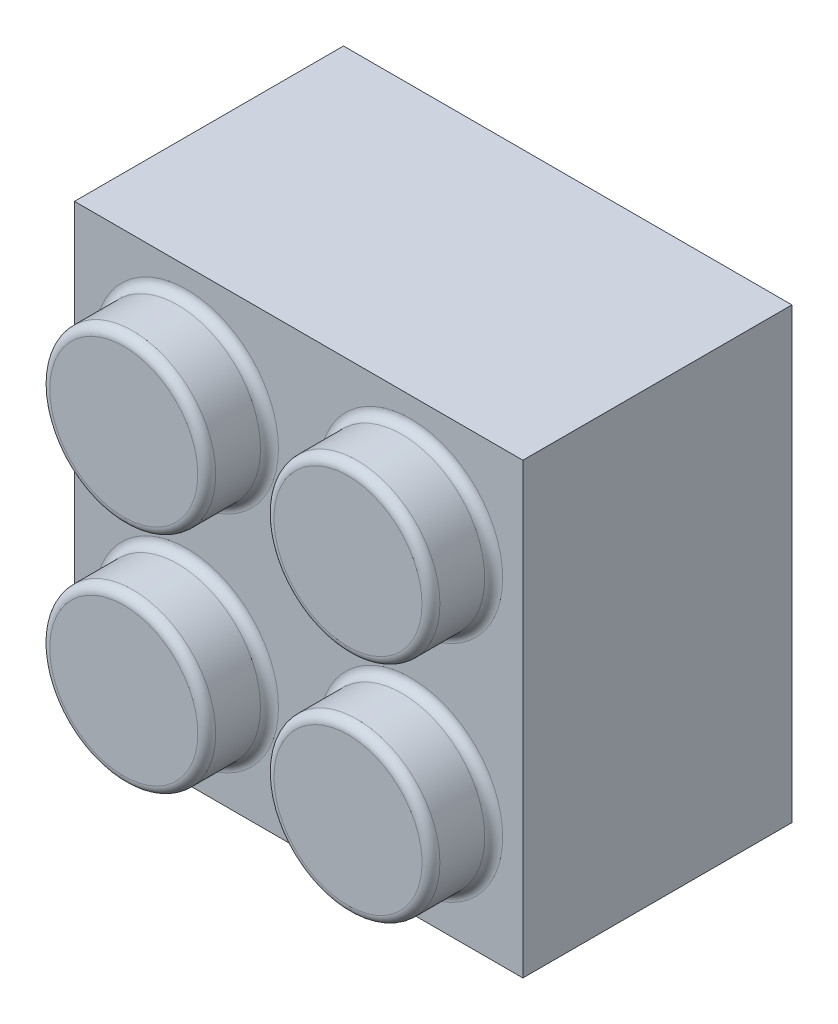
from build123d import *

# Parameters (mm, degrees)
ESQUISSE2_W             = 100
ESQUISSE2_H             = 100
BOSS_EXTRU_1_DEPTH      = 60
ESQUISSE3_R             = 18.5
BOSS_EXTRU_2_DEPTH      = 14
ESQUISSE4_W             = 84
ESQUISSE4_H             = 84
ESQUISSE4_R             = 18.5
ESQUISSE4_R_2           = 12
ENL_V_MAT_EXTRU_4_DEPTH = 50
CONG_1_R                = 2


with BuildPart() as part:
    # Esquisse2 → Boss.-Extru.1 (new body)
    with BuildSketch(Plane.XY):
        Rectangle(ESQUISSE2_W, ESQUISSE2_H)
    extrude(amount=BOSS_EXTRU_1_DEPTH)

    # Esquisse3 → Boss.-Extru.2 (add)
    with BuildSketch(Plane.XY.offset(60)):
        with Locations((25, 25)):
            Circle(ESQUISSE3_R)
        with Locations(Location((25, -25, 0), (0, 0, 180))):
            Circle(ESQUISSE3_R)
        with Locations(Location((-25, 25, 0), (0, 0, 180))):
            Circle(ESQUISSE3_R)
        with Locations((-25, -25)):
            Circle(ESQUISSE3_R)
    extrude(amount=BOSS_EXTRU_2_DEPTH)

    # Esquisse4 → Enlèv. mat.-Extru.4 (cut)
    # profile 1 of 2: a face of its own
    with BuildSketch(Plane(origin=(0, 0, 0), x_dir=(-1, 0, 0), z_dir=(0, 0, -1))):
        Rectangle(ESQUISSE4_W, ESQUISSE4_H)
        Circle(ESQUISSE4_R, mode=Mode.SUBTRACT)
    # profile 2 of 2: a face of its own
    with BuildSketch(Plane(origin=(0, 0, 0), x_dir=(-1, 0, 0), z_dir=(0, 0, -1))):
        Circle(ESQUISSE4_R_2)
    extrude(amount=-ENL_V_MAT_EXTRU_4_DEPTH, mode=Mode.SUBTRACT)

    # Congé1
    cong_1_edges = [part.edges().sort_by_distance(p)[0] for p in [
        (6.5, 25, 60),
        (6.5, 25, 74),
        (43.5, -25, 60),
        (43.5, -25, 74),
        (-6.5, 25, 60),
        (-6.5, 25, 74),
        (-43.5, -25, 60),
        (-43.5, -25, 74),
    ]]
    fillet(cong_1_edges, radius=CONG_1_R)


solid = part.part
